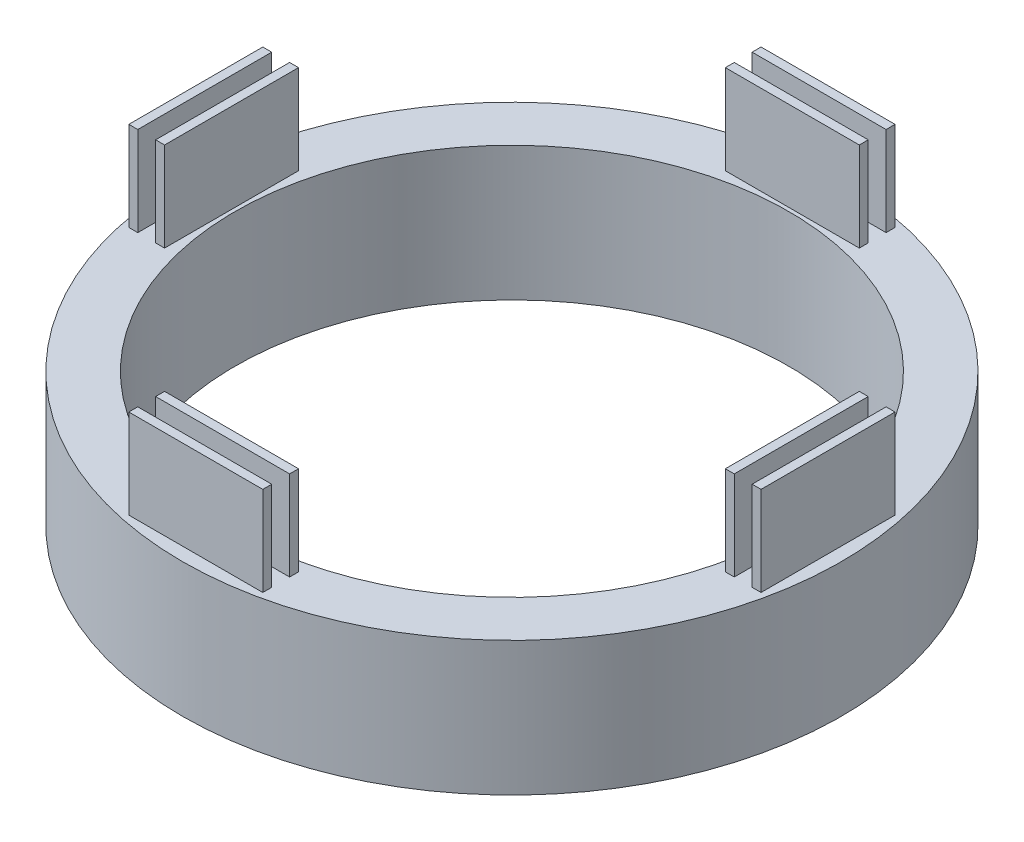
from build123d import *

# Parameters (mm, degrees)
ESQUISSE1_R        = 73.8
ESQUISSE1_R_2      = 62
BOSS_EXTRU_1_DEPTH = 30
ESQUISSE2_W        = 2
ESQUISSE2_H        = 15
ESQUISSE2_W_2      = 30
ESQUISSE2_H_2      = 2
BOSS_EXTRU_2_DEPTH = 20


with BuildPart() as part:
    # Esquisse1 → Boss.-Extru.1 (new body)
    with BuildSketch(Plane(origin=(0, 0, 0), x_dir=(1, 0, 0), z_dir=(0, 1, 0))):
        with Locations(Location((0, 0, 0), (0, 0, 270))):
            Circle(ESQUISSE1_R)
        with Locations(Location((0, 0, 0), (0, 0, 270))):
            Circle(ESQUISSE1_R_2, mode=Mode.SUBTRACT)
    extrude(amount=BOSS_EXTRU_1_DEPTH)

    # Esquisse2 → Boss.-Extru.2 (add)
    with BuildSketch(Plane(origin=(0, 30, 0), x_dir=(1, 0, 0), z_dir=(0, 1, 0))):
        with Locations((-69.786402014, 7.5)):
            Rectangle(ESQUISSE2_W, ESQUISSE2_H)
        with Locations((-69.786402014, -7.5)):
            Rectangle(ESQUISSE2_W, ESQUISSE2_H)
        with Locations((-63.786402014, -7.5)):
            Rectangle(ESQUISSE2_W, ESQUISSE2_H)
        with Locations((-63.786402014, 7.5)):
            Rectangle(ESQUISSE2_W, ESQUISSE2_H)
        with Locations((0, 69.786402014)):
            Rectangle(ESQUISSE2_W_2, ESQUISSE2_H_2)
        with Locations((0, 63.786402014)):
            Rectangle(ESQUISSE2_W_2, ESQUISSE2_H_2)
        with Locations((63.786402014, -7.5)):
            Rectangle(ESQUISSE2_W, ESQUISSE2_H)
        with Locations((63.786402014, 7.5)):
            Rectangle(ESQUISSE2_W, ESQUISSE2_H)
        with Locations((69.786402014, 7.5)):
            Rectangle(ESQUISSE2_W, ESQUISSE2_H)
        with Locations((69.786402014, -7.5)):
            Rectangle(ESQUISSE2_W, ESQUISSE2_H)
        with Locations((0, -69.786402014)):
            Rectangle(ESQUISSE2_W_2, ESQUISSE2_H_2)
        with Locations((0, -63.786402014)):
            Rectangle(ESQUISSE2_W_2, ESQUISSE2_H_2)
    extrude(amount=BOSS_EXTRU_2_DEPTH)


solid = part.part
